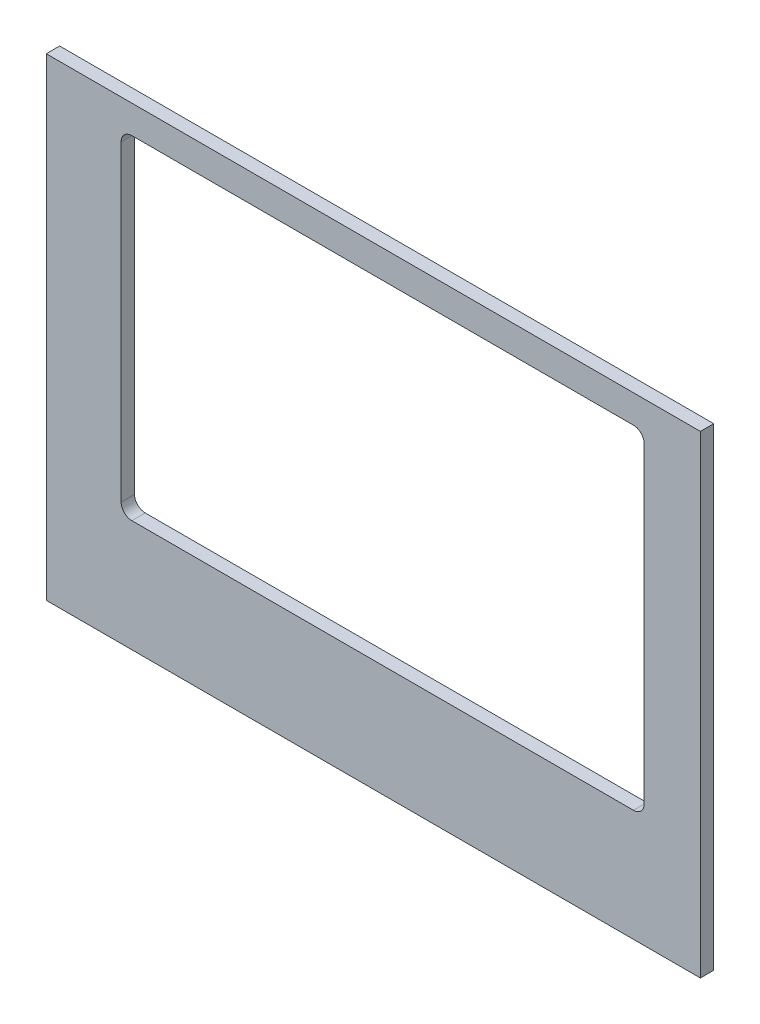
from build123d import *

# Parameters (mm, degrees)
BOSS_EXTRUDE1_DEPTH = 3.175
SKETCH2_W           = 3.175
SKETCH2_H           = 112.395
BOSS_EXTRUDE2_DEPTH = 3.175
FILLET1_R           = 2.54


with BuildPart() as part:
    # Sketch1 → Boss-Extrude1 (new body)
    with BuildSketch(Plane.XY):
        Polygon((61.2775, 1.5875), (61.2775, -56.1975), (0, -56.1975), (-90.8525, -56.1975), (-90.8525, 5.302053944), (-90.8525, 56.1975), (-7.104289944, 56.1975), (61.2775, 56.1975), align=None)
        Polygon((-73.0725, -29.6525), (-10.985, -29.6525), (51.1025, -29.6525), (51.1025, 9.935), (51.1025, 49.5225), (-10.985, 49.5225), (-73.0725, 49.5225), (-73.0725, 47.935), (-73.0725, 9.935), align=None, mode=Mode.SUBTRACT)
    extrude(amount=BOSS_EXTRUDE1_DEPTH)

    # Sketch2 → Boss-Extrude2 (add)
    with BuildSketch(Plane(origin=(61.2775, 0, 0), x_dir=(0, 0, -1), z_dir=(1, 0, 0))):
        with Locations((-1.5875, 0)):
            Rectangle(SKETCH2_W, SKETCH2_H)
    extrude(amount=BOSS_EXTRUDE2_DEPTH)

    # Fillet1
    fillet1_edges = [part.edges().sort_by_distance(p)[0] for p in [
        (51.1025, -29.6525, 1.5875),
        (51.1025, 49.5225, 1.5875),
        (-73.0725, 49.5225, 1.5875),
        (-73.0725, -29.6525, 1.5875),
    ]]
    fillet(fillet1_edges, radius=FILLET1_R)


solid = part.part
